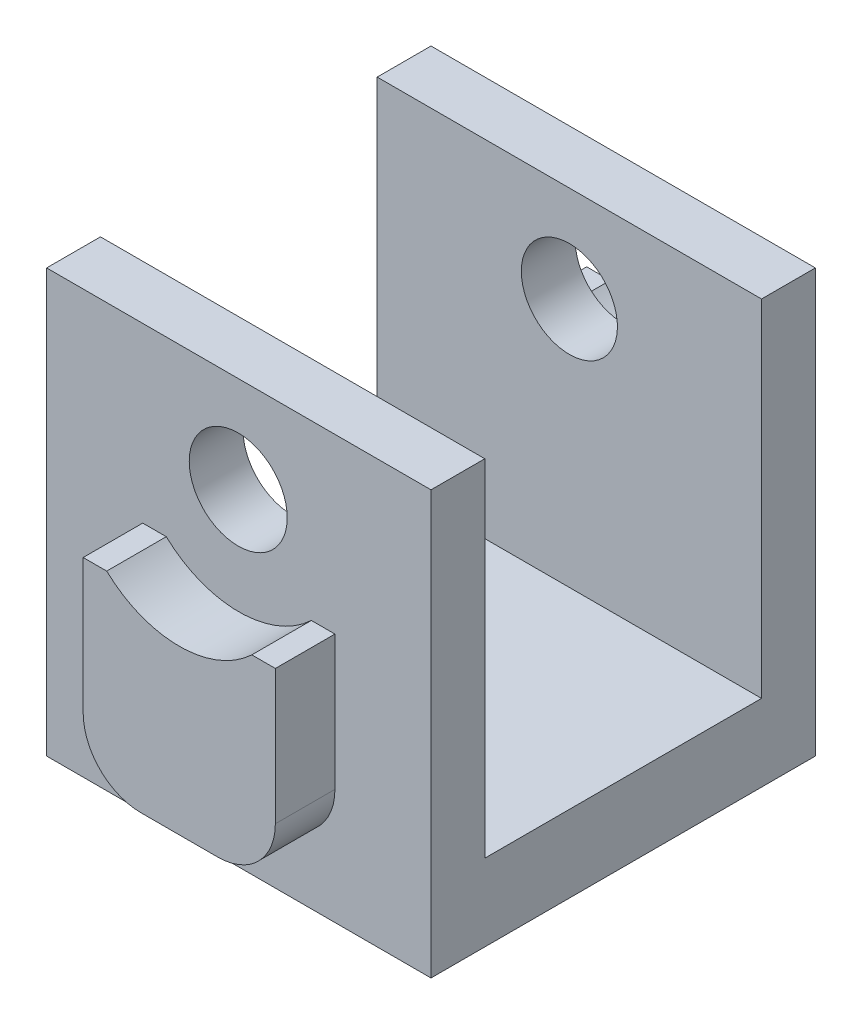
from build123d import *

# Parameters (mm, degrees)
SKETCH114_W          = 20
SKETCH114_H          = 22
BOSS_EXTRUDE16_DEPTH = 20
SKETCH115_W          = 14.4
SKETCH115_H          = 18
CUT_EXTRUDE6_DEPTH   = 48.889560449
BOSS_EXTRUDE17_DEPTH = 3.1
BOSS_EXTRUDE18_DEPTH = 3.1
SKETCH123_W          = 2.5
SKETCH123_H          = 2.801
FILLET6_R            = 3
FILLET7_R            = 3
SKETCH128_W          = 2.55
SKETCH128_H          = 5.9


with BuildPart() as part:
    # Sketch114 → Boss-Extrude16 (new body)
    with BuildSketch(Plane(origin=(20.1, 0, 0), x_dir=(0, 0, -1), z_dir=(1, 0, 0))):
        with Locations((-12.9, 26)):
            Rectangle(SKETCH114_W, SKETCH114_H)
    extrude(amount=-BOSS_EXTRUDE16_DEPTH)

    # Sketch115 → Cut-Extrude6 (cut, through all)
    with BuildSketch(Plane.ZY.offset(-0.1)):
        with Locations((12.9, 28)):
            Rectangle(SKETCH115_W, SKETCH115_H)
    extrude(amount=-CUT_EXTRUDE6_DEPTH, mode=Mode.SUBTRACT)

    # Sketch122 → Boss-Extrude18 (add)
    with BuildSketch(Plane(origin=(0, 0, 2.9), x_dir=(-1, 0, 0), z_dir=(0, 0, -1))):
        with BuildLine():
            Line((-15.1, 18), (-15.1, 28))
            Line((-15.1, 28), (-13.874917218, 28))
            ThreePointArc((-13.874917218, 28), (-10.1, 26.5), (-6.325082782, 28))
            Line((-6.325082782, 28), (-5.1, 28))
            Line((-5.1, 28), (-5.1, 18))
            Line((-5.1, 18), (-15.1, 18))
        make_face()
    extrude(amount=BOSS_EXTRUDE18_DEPTH)

    # Sketch123 → Ø5.0 (5) Diameter Hole1 (revolve, cut)
    with BuildSketch(Plane(origin=(10.1, 32, 2.9), x_dir=(0, 1, 0), z_dir=(1, 0, 0))):
        with Locations((1.25, 1.4005)):
            Rectangle(SKETCH123_W, SKETCH123_H)
    revolve(axis=Axis((10.1, 32, -3.45), (0, 0, 1)), mode=Mode.SUBTRACT)

    # Sketch125 → CBORE for M2 Hex Head Machine Screw6 (revolve, cut)
    with BuildSketch(Plane(origin=(10.1, 15, 12.9), x_dir=(0, 0, -1), z_dir=(1, 0, 0))):
        Polygon((0, 0), (0, 4), (1.2645, 4), (1.2645, 1), (3.1, 1), (3.1, 0), align=None)
    revolve(axis=Axis((10.1, 8.65, 12.9), (0, 1, 0)), mode=Mode.SUBTRACT)

    # Fillet7
    fillet7_edges = [part.edges().sort_by_distance(p)[0] for p in [
        (15.1, 18, 1.35),
        (5.1, 18, 1.35),
    ]]
    fillet(fillet7_edges, radius=FILLET7_R)

    # Sketch128 → Ø5.1 (5.1) Diameter Hole1 (revolve, cut)
    with BuildSketch(Plane(origin=(10.069319505, 31.99803671, 20.1), x_dir=(0, 1, 0), z_dir=(1, 0, 0))):
        with Locations((1.275, 2.95)):
            Rectangle(SKETCH128_W, SKETCH128_H)
    revolve(axis=Axis((10.069319505, 31.99803671, 13.75), (0, 0, 1)), mode=Mode.SUBTRACT)


with BuildPart() as body_2:
    # Sketch121 → Boss-Extrude17 (new body)
    with BuildSketch(Plane.XY.offset(22.9)):
        with BuildLine():
            Line((5.1, 28), (6.325082782, 28))
            ThreePointArc((6.325082782, 28), (10.1, 26.5), (13.874917218, 28))
            Line((13.874917218, 28), (15.1, 28))
            Line((15.1, 28), (15.1, 18))
            Line((15.1, 18), (5.1, 18))
            Line((5.1, 18), (5.1, 28))
        make_face()
    extrude(amount=BOSS_EXTRUDE17_DEPTH)

    # Fillet6
    fillet6_edges = [body_2.edges().sort_by_distance(p)[0] for p in [
        (15.1, 18, 24.45),
        (5.1, 18, 24.45),
    ]]
    fillet(fillet6_edges, radius=FILLET6_R)


solid = Compound([part.part, body_2.part])
